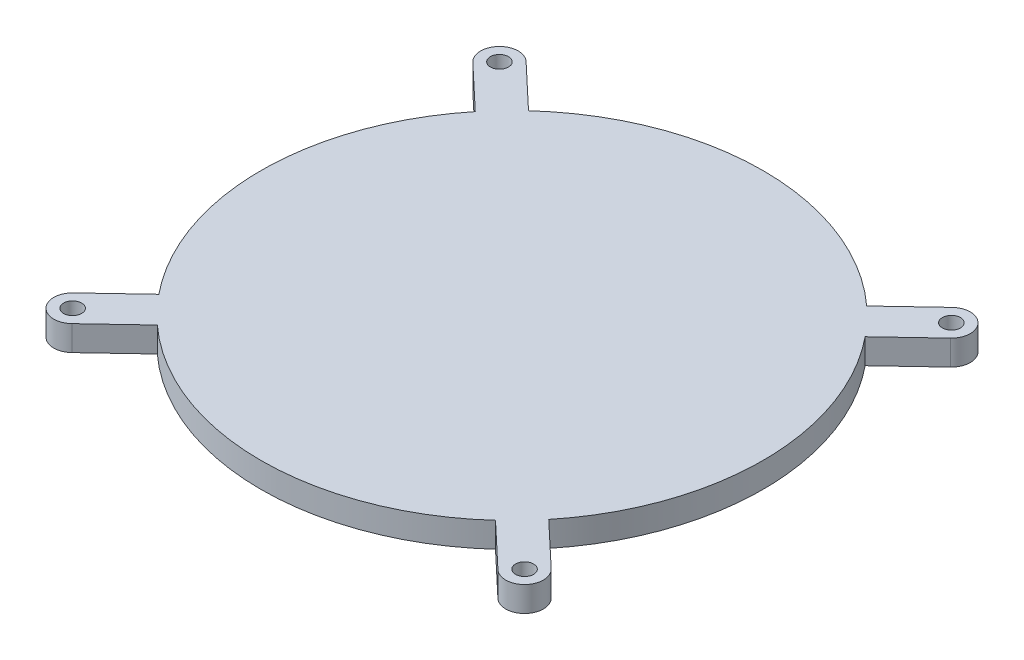
from build123d import *

# Parameters (mm, degrees)
BOSS_EXTRU_1_DEPTH = 5
D_GAGEMENT_M31_D   = 3.6


with BuildPart() as part:
    # Esquisse1 → Boss.-Extru.1 (new body)
    with BuildSketch(Plane(origin=(0, 0, 0), x_dir=(1, 0, 0), z_dir=(0, 1, 0))):
        with BuildLine():
            Line((-47.574838249, 39.773700678), (-38.823115476, 31.508184726))
            ThreePointArc((-38.823115476, 31.508184726), (-50, 0), (-38.823115476, -31.508184726))
            Line((-38.823115476, -31.508184726), (-47.574838249, -39.773700678))
            ThreePointArc((-47.574838249, -39.773700678), (-47.726299322, -45.074838249), (-42.425161751, -45.226299322))
            Line((-42.425161751, -45.226299322), (-33.673438979, -36.96078337))
            ThreePointArc((-33.673438979, -36.96078337), (0, -50), (33.673438979, -36.96078337))
            Line((33.673438979, -36.96078337), (42.425161751, -45.226299322))
            ThreePointArc((42.425161751, -45.226299322), (47.726299322, -45.074838249), (47.574838249, -39.773700678))
            Line((47.574838249, -39.773700678), (38.823115476, -31.508184726))
            ThreePointArc((38.823115476, -31.508184726), (50, 0), (38.823115476, 31.508184726))
            Line((38.823115476, 31.508184726), (47.574838249, 39.773700678))
            ThreePointArc((47.574838249, 39.773700678), (47.726299322, 45.074838249), (42.425161751, 45.226299322))
            Line((42.425161751, 45.226299322), (33.673438979, 36.96078337))
            ThreePointArc((33.673438979, 36.96078337), (0, 50), (-33.673438979, 36.96078337))
            Line((-33.673438979, 36.96078337), (-42.425161751, 45.226299322))
            ThreePointArc((-42.425161751, 45.226299322), (-47.726299322, 45.074838249), (-47.574838249, 39.773700678))
        make_face()
    extrude(amount=BOSS_EXTRU_1_DEPTH)

    # Dégagement M31 (through all)
    with Locations(Plane(origin=(-45, 5, 42.5), x_dir=(0, 0, 1), z_dir=(0, 1, 0))):
        with Locations((0, 0), (-85, 0), (-85, 90), (0, 90)):
            Hole(D_GAGEMENT_M31_D / 2)


solid = part.part
